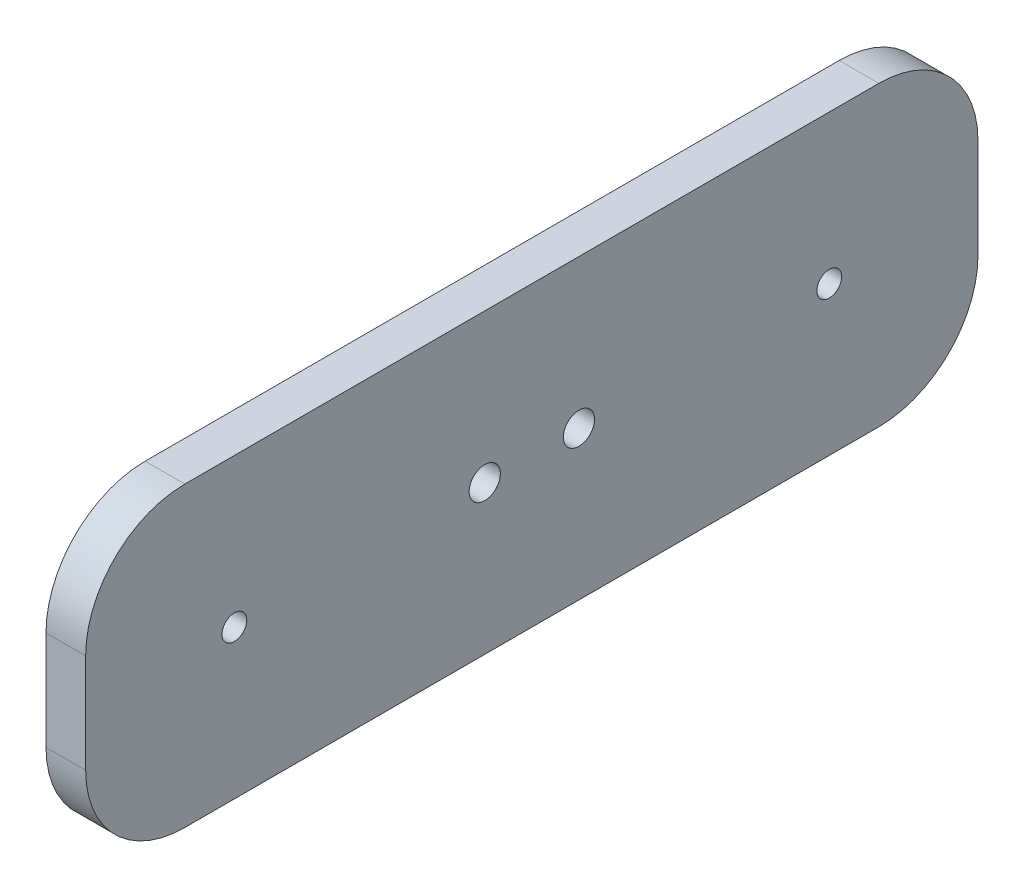
from build123d import *

# Parameters (mm, degrees)
SKETCH1_W           = 90
SKETCH1_H           = 30
BOSS_EXTRUDE1_DEPTH = 4
SKETCH6_R           = 1.575
CUT_EXTRUDE6_DEPTH  = 48.602520942
SKETCH7_R           = 1.575
CUT_EXTRUDE7_DEPTH  = 48.602520942
SKETCH13_R          = 1.25
CUT_EXTRUDE13_DEPTH = 48.602520942
SKETCH14_R          = 1.25
CUT_EXTRUDE14_DEPTH = 48.602520942
FILLET1_R           = 10


with BuildPart() as part:
    # Sketch1 → Boss-Extrude1 (new body)
    with BuildSketch(Plane(origin=(0, 0, 0), x_dir=(0, 0, -1), z_dir=(1, 0, 0))):
        Rectangle(SKETCH1_W, SKETCH1_H)
    extrude(amount=BOSS_EXTRUDE1_DEPTH)

    # Sketch6 → Cut-Extrude6 (cut, through all)
    with BuildSketch(Plane(origin=(4, 0, 0), x_dir=(0, 0, -1), z_dir=(1, 0, 0))):
        with Locations((-4.75, 0)):
            Circle(SKETCH6_R)
    extrude(amount=-CUT_EXTRUDE6_DEPTH, mode=Mode.SUBTRACT)

    # Sketch7 → Cut-Extrude7 (cut, through all)
    with BuildSketch(Plane(origin=(4, 0, 0), x_dir=(0, 0, -1), z_dir=(1, 0, 0))):
        with Locations((4.75, 0)):
            Circle(SKETCH7_R)
    extrude(amount=-CUT_EXTRUDE7_DEPTH, mode=Mode.SUBTRACT)

    # Sketch13 → Cut-Extrude13 (cut, through all)
    with BuildSketch(Plane(origin=(4, 0, 0), x_dir=(0, 0, -1), z_dir=(1, 0, 0))):
        with Locations((-30, 0)):
            Circle(SKETCH13_R)
    extrude(amount=-CUT_EXTRUDE13_DEPTH, mode=Mode.SUBTRACT)

    # Sketch14 → Cut-Extrude14 (cut, through all)
    with BuildSketch(Plane(origin=(4, 0, 0), x_dir=(0, 0, -1), z_dir=(1, 0, 0))):
        with Locations((30, 0)):
            Circle(SKETCH14_R)
    extrude(amount=-CUT_EXTRUDE14_DEPTH, mode=Mode.SUBTRACT)

    # Fillet1
    fillet1_edges = [part.edges().sort_by_distance(p)[0] for p in [
        (2, -15, -45),
        (2, -15, 45),
        (2, 15, 45),
        (2, 15, -45),
    ]]
    fillet(fillet1_edges, radius=FILLET1_R)


solid = part.part
